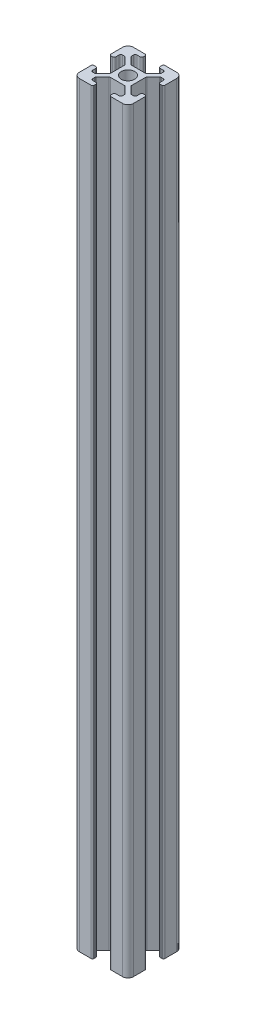
from build123d import *

# Parameters (mm, degrees)
SKETCH_1_R      = 2.5
EXTRUDE_1_DEPTH = 280


with BuildPart() as part:
    # 草图1 → 凸台-拉伸1 (new body)
    with BuildSketch(Plane(origin=(0, 0, 0), x_dir=(1, 0, 0), z_dir=(0, 1, 0))):
        with BuildLine():
            Line((3.1, 8.8), (3.1, 9.4))
            ThreePointArc((3.1, 9.4), (3.275735931, 9.824264069), (3.7, 10))
            Line((3.7, 10), (8, 10))
            ThreePointArc((8, 10), (9.414213562, 9.414213562), (10, 8))
            Line((10, 8), (10, 3.7))
            ThreePointArc((10, 3.7), (9.824264069, 3.275735931), (9.4, 3.1))
            Line((9.4, 3.1), (8.8, 3.1))
            ThreePointArc((8.8, 3.1), (8.375735931, 3.275735931), (8.2, 3.7))
            Line((8.2, 3.7), (8.2, 4.9))
            ThreePointArc((8.2, 4.9), (8.024264069, 5.324264069), (7.6, 5.5))
            Line((7.6, 5.5), (6.809188309, 5.5))
            ThreePointArc((6.809188309, 5.5), (6.57957825, 5.45432772), (6.38492424, 5.324264069))
            Line((6.38492424, 5.324264069), (4.075735931, 3.01507576))
            ThreePointArc((4.075735931, 3.01507576), (3.94567228, 2.82042175), (3.9, 2.590811691))
            Line((3.9, 2.590811691), (3.9, 0))
            Line((3.9, 0), (3.9, -2.590811691))
            ThreePointArc((3.9, -2.590811691), (3.94567228, -2.82042175), (4.075735931, -3.01507576))
            Line((4.075735931, -3.01507576), (6.38492424, -5.324264069))
            ThreePointArc((6.38492424, -5.324264069), (6.57957825, -5.45432772), (6.809188309, -5.5))
            Line((6.809188309, -5.5), (7.6, -5.5))
            ThreePointArc((7.6, -5.5), (8.024264069, -5.324264069), (8.2, -4.9))
            Line((8.2, -4.9), (8.2, -3.7))
            ThreePointArc((8.2, -3.7), (8.375735931, -3.275735931), (8.8, -3.1))
            Line((8.8, -3.1), (9.4, -3.1))
            ThreePointArc((9.4, -3.1), (9.824264069, -3.275735931), (10, -3.7))
            Line((10, -3.7), (10, -8))
            ThreePointArc((10, -8), (9.414213562, -9.414213562), (8, -10))
            Line((8, -10), (3.7, -10))
            ThreePointArc((3.7, -10), (3.275735931, -9.824264069), (3.1, -9.4))
            Line((3.1, -9.4), (3.1, -8.8))
            ThreePointArc((3.1, -8.8), (3.275735931, -8.375735931), (3.7, -8.2))
            Line((3.7, -8.2), (4.9, -8.2))
            ThreePointArc((4.9, -8.2), (5.324264069, -8.024264069), (5.5, -7.6))
            Line((5.5, -7.6), (5.5, -6.809188309))
            ThreePointArc((5.5, -6.809188309), (5.45432772, -6.57957825), (5.324264069, -6.38492424))
            Line((5.324264069, -6.38492424), (3.01507576, -4.075735931))
            ThreePointArc((3.01507576, -4.075735931), (2.82042175, -3.94567228), (2.590811691, -3.9))
            Line((2.590811691, -3.9), (0, -3.9))
            Line((0, -3.9), (-2.590811691, -3.9))
            ThreePointArc((-2.590811691, -3.9), (-2.82042175, -3.94567228), (-3.01507576, -4.075735931))
            Line((-3.01507576, -4.075735931), (-5.324264069, -6.38492424))
            ThreePointArc((-5.324264069, -6.38492424), (-5.45432772, -6.57957825), (-5.5, -6.809188309))
            Line((-5.5, -6.809188309), (-5.5, -7.6))
            ThreePointArc((-5.5, -7.6), (-5.324264069, -8.024264069), (-4.9, -8.2))
            Line((-4.9, -8.2), (-3.7, -8.2))
            ThreePointArc((-3.7, -8.2), (-3.275735931, -8.375735931), (-3.1, -8.8))
            Line((-3.1, -8.8), (-3.1, -9.4))
            ThreePointArc((-3.1, -9.4), (-3.275735931, -9.824264069), (-3.7, -10))
            Line((-3.7, -10), (-8, -10))
            ThreePointArc((-8, -10), (-9.414213562, -9.414213562), (-10, -8))
            Line((-10, -8), (-10, -3.7))
            ThreePointArc((-10, -3.7), (-9.824264069, -3.275735931), (-9.4, -3.1))
            Line((-9.4, -3.1), (-8.8, -3.1))
            ThreePointArc((-8.8, -3.1), (-8.375735931, -3.275735931), (-8.2, -3.7))
            Line((-8.2, -3.7), (-8.2, -4.9))
            ThreePointArc((-8.2, -4.9), (-8.024264069, -5.324264069), (-7.6, -5.5))
            Line((-7.6, -5.5), (-6.809188309, -5.5))
            ThreePointArc((-6.809188309, -5.5), (-6.57957825, -5.45432772), (-6.38492424, -5.324264069))
            Line((-6.38492424, -5.324264069), (-4.075735931, -3.01507576))
            ThreePointArc((-4.075735931, -3.01507576), (-3.94567228, -2.82042175), (-3.9, -2.590811691))
            Line((-3.9, -2.590811691), (-3.9, 0))
            Line((-3.9, 0), (-3.9, 2.590811691))
            ThreePointArc((-3.9, 2.590811691), (-3.94567228, 2.82042175), (-4.075735931, 3.01507576))
            Line((-4.075735931, 3.01507576), (-6.38492424, 5.324264069))
            ThreePointArc((-6.38492424, 5.324264069), (-6.57957825, 5.45432772), (-6.809188309, 5.5))
            Line((-6.809188309, 5.5), (-7.6, 5.5))
            ThreePointArc((-7.6, 5.5), (-8.024264069, 5.324264069), (-8.2, 4.9))
            Line((-8.2, 4.9), (-8.2, 3.7))
            ThreePointArc((-8.2, 3.7), (-8.375735931, 3.275735931), (-8.8, 3.1))
            Line((-8.8, 3.1), (-9.4, 3.1))
            ThreePointArc((-9.4, 3.1), (-9.824264069, 3.275735931), (-10, 3.7))
            Line((-10, 3.7), (-10, 8))
            ThreePointArc((-10, 8), (-9.414213562, 9.414213562), (-8, 10))
            Line((-8, 10), (-3.7, 10))
            ThreePointArc((-3.7, 10), (-3.275735931, 9.824264069), (-3.1, 9.4))
            Line((-3.1, 9.4), (-3.1, 8.8))
            ThreePointArc((-3.1, 8.8), (-3.275735931, 8.375735931), (-3.7, 8.2))
            Line((-3.7, 8.2), (-4.9, 8.2))
            ThreePointArc((-4.9, 8.2), (-5.324264069, 8.024264069), (-5.5, 7.6))
            Line((-5.5, 7.6), (-5.5, 6.809188309))
            ThreePointArc((-5.5, 6.809188309), (-5.45432772, 6.57957825), (-5.324264069, 6.38492424))
            Line((-5.324264069, 6.38492424), (-3.01507576, 4.075735931))
            ThreePointArc((-3.01507576, 4.075735931), (-2.82042175, 3.94567228), (-2.590811691, 3.9))
            Line((-2.590811691, 3.9), (0, 3.9))
            Line((0, 3.9), (2.590811691, 3.9))
            ThreePointArc((2.590811691, 3.9), (2.82042175, 3.94567228), (3.01507576, 4.075735931))
            Line((3.01507576, 4.075735931), (5.324264069, 6.38492424))
            ThreePointArc((5.324264069, 6.38492424), (5.45432772, 6.57957825), (5.5, 6.809188309))
            Line((5.5, 6.809188309), (5.5, 7.6))
            ThreePointArc((5.5, 7.6), (5.324264069, 8.024264069), (4.9, 8.2))
            Line((4.9, 8.2), (3.7, 8.2))
            ThreePointArc((3.7, 8.2), (3.275735931, 8.375735931), (3.1, 8.8))
        make_face()
        with Locations(Location((0, 0, 0), (0, 0, 270))):
            Circle(SKETCH_1_R, mode=Mode.SUBTRACT)
    extrude(amount=EXTRUDE_1_DEPTH)


solid = part.part
